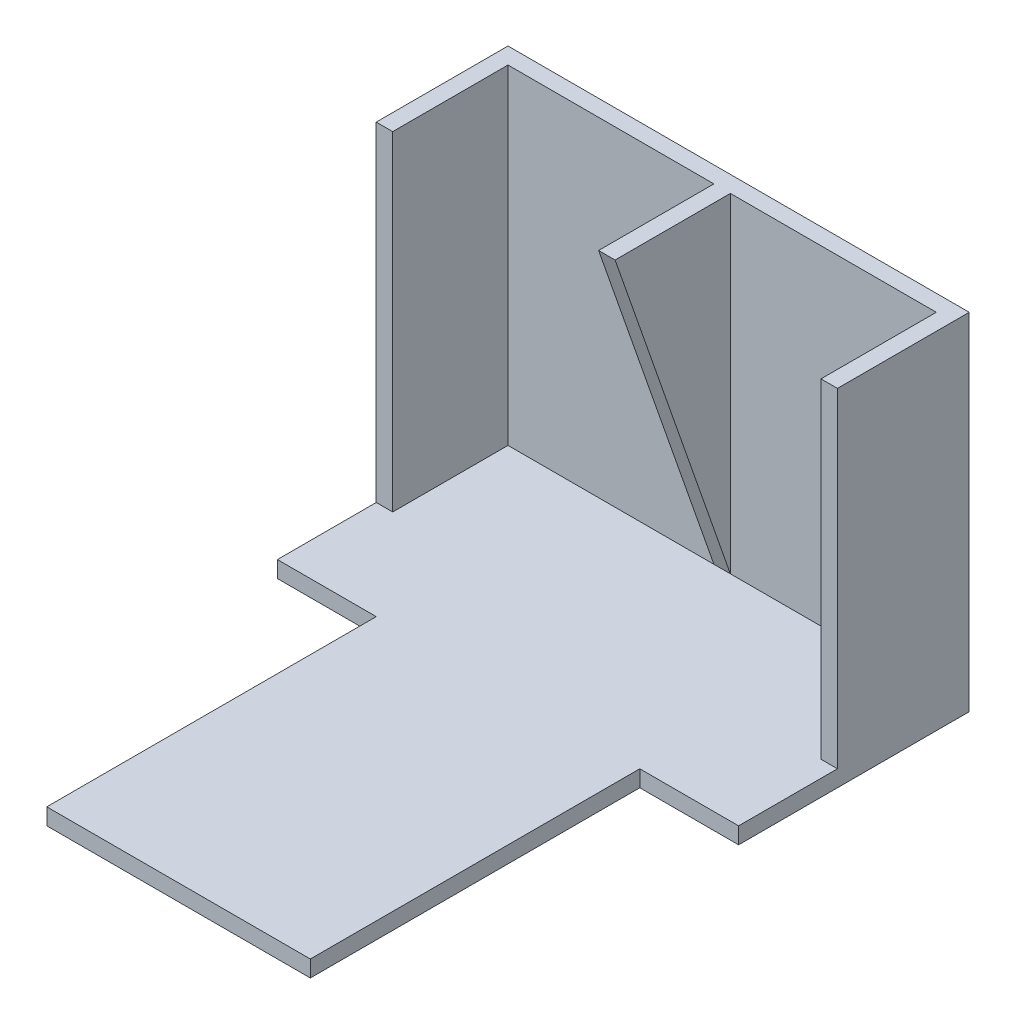
from build123d import *

# Parameters (mm, degrees)
BOSS_EXTRUDE1_DEPTH = 2.5
BOSS_EXTRUDE2_DEPTH = 50
CUT_EXTRUDE1_REACH  = 94.879


with BuildPart() as part:
    # Sketch1 → Boss-Extrude1 (new body)
    with BuildSketch(Plane(origin=(0, 0, 0), x_dir=(1, 0, 0), z_dir=(0, 1, 0))):
        Polygon((20, -17.5), (35, -17.5), (35, 17.5), (-35, 17.5), (-35, -17.5), (-20, -17.5), (-20, -67.5), (20, -67.5), align=None)
    extrude(amount=BOSS_EXTRUDE1_DEPTH)

    # Sketch3 → Boss-Extrude2 (add)
    with BuildSketch(Plane(origin=(0, 2.5, 0), x_dir=(1, 0, 0), z_dir=(0, 1, 0))):
        Polygon((-35, 17.5), (-32.5, 17.5), (32.5, 17.5), (35, 17.5), (35, -2.5), (32.5, -2.5), (32.5, 15), (1.25, 15), (1.25, -2.5), (-1.25, -2.5), (-1.25, 15), (-32.5, 15), (-32.5, -2.5), (-35, -2.5), align=None)
    extrude(amount=BOSS_EXTRUDE2_DEPTH)

    # Sketch4 → Cut-Extrude1 (cut, up to next)
    with BuildSketch(Plane(origin=(1.25, 0, 0), x_dir=(0, 0, -1), z_dir=(1, 0, 0)), mode=Mode.PRIVATE) as cut_extrude1_sk1:
        Polygon((15, 2.5), (-2.5, 52.5), (-2.5, 2.5), align=None)
    cut_extrude1_tool1 = extrude(cut_extrude1_sk1.sketch, amount=-CUT_EXTRUDE1_REACH, mode=Mode.PRIVATE) & part.part
    add(cut_extrude1_tool1.solids().sort_by_distance((1.25, 19.166667, -3.333333))[0], mode=Mode.SUBTRACT)


solid = part.part
